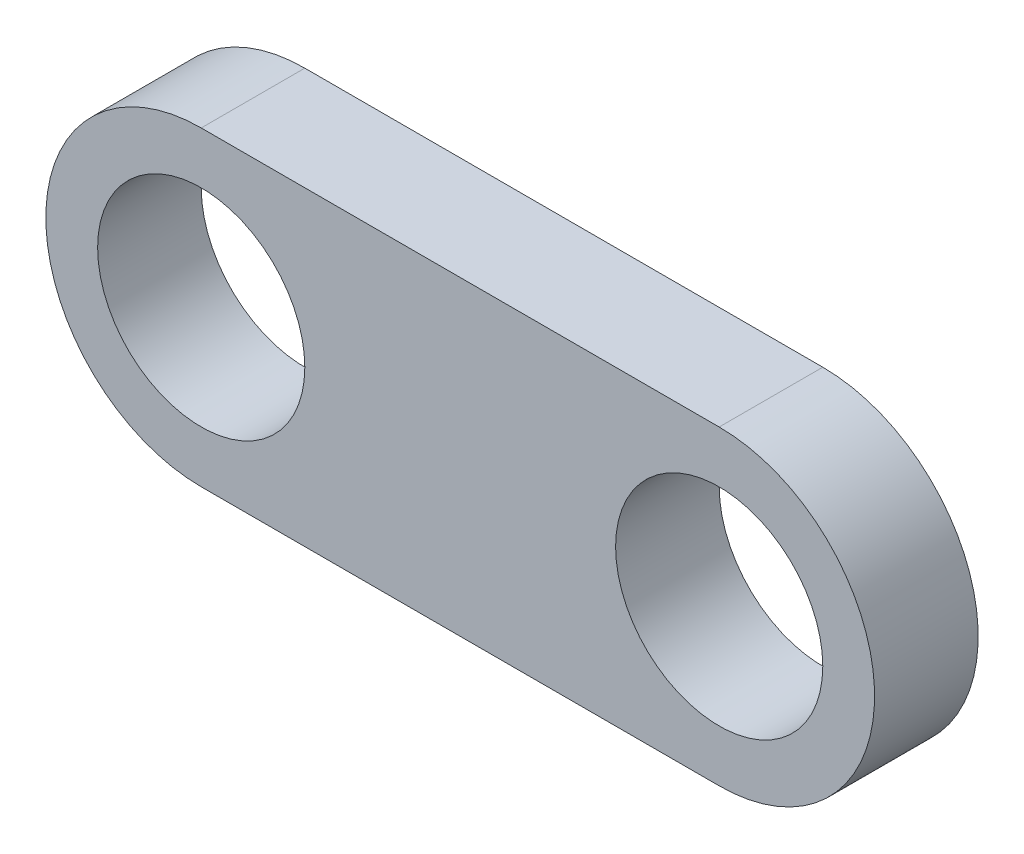
from build123d import *

# Parameters (mm, degrees)
SKETCH1_R           = 10
BOSS_EXTRUDE1_DEPTH = 5


with BuildPart() as part:
    # Sketch1 → Boss-Extrude1 (new, symmetric)
    with BuildSketch(Plane.XY):
        with BuildLine():
            Line((0, -15), (-50, -15))
            ThreePointArc((-50, -15), (-65, 0), (-50, 15))
            Line((-50, 15), (0, 15))
            ThreePointArc((0, 15), (15, 0), (0, -15))
        make_face()
        with Locations((-50, 0)):
            Circle(SKETCH1_R, mode=Mode.SUBTRACT)
        Circle(SKETCH1_R, mode=Mode.SUBTRACT)
    extrude(amount=BOSS_EXTRUDE1_DEPTH, both=True)


solid = part.part
